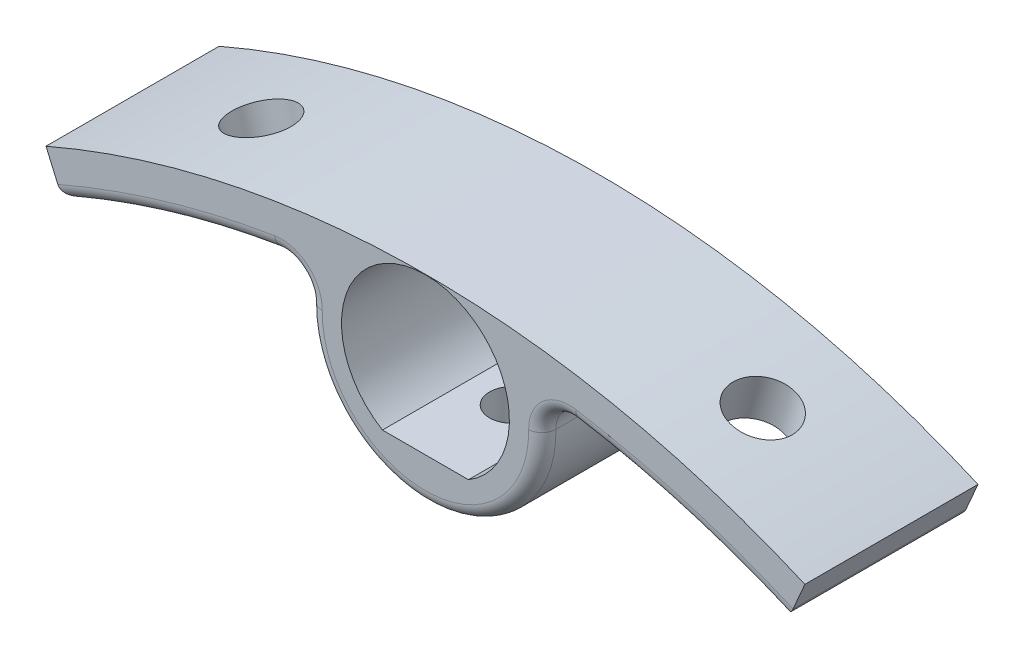
from build123d import *

# Parameters (mm, degrees)
BOSS_EXTRUDE1_DEPTH = 12.7
SKETCH2_R           = 1.651
CUT_EXTRUDE1_DEPTH  = 33.458037303
SKETCH4_R           = 2.25298
CUT_EXTRUDE3_DEPTH  = 34.719236888
FILLET1_R           = 2
FILLET2_R           = 1
CUT_EXTRUDE4_DEPTH  = 34.974608094


with BuildPart() as part:
    # Sketch1 → Boss-Extrude1 (new body)
    with BuildSketch(Plane.XY):
        with BuildLine():
            Line((-27.839103255, -5.787477181), (-26.57368947, -8.699410036))
            ThreePointArc((-26.57368947, -8.699410036), (-17.565333038, -5.530370801), (-8.196652556, -3.680743454))
            ThreePointArc((-8.196652556, -3.680743454), (0, -14.76375), (8.196652556, -3.680743454))
            ThreePointArc((8.196652556, -3.680743454), (17.565333038, -5.530370801), (26.57368947, -8.699410036))
            Line((26.57368947, -8.699410036), (27.839103255, -5.787477181))
            ThreePointArc((27.839103255, -5.787477181), (0, 0), (-27.839103255, -5.787477181))
        make_face()
        with BuildLine():
            Line((-2.764985714, -10.82675), (2.764985714, -10.82675))
            ThreePointArc((2.764985714, -10.82675), (0, -0.79375), (-2.764985714, -10.82675))
        make_face(mode=Mode.SUBTRACT)
    extrude(amount=BOSS_EXTRUDE1_DEPTH)

    # Sketch2 → Cut-Extrude1 (cut, through all)
    with BuildSketch(Plane(origin=(0, -10.82675, 0), x_dir=(1, 0, 0), z_dir=(0, 1, 0))):
        with Locations(Location((0, -6.35, 0), (0, 0, 270))):
            Circle(SKETCH2_R)
    extrude(amount=-CUT_EXTRUDE1_DEPTH, mode=Mode.SUBTRACT)

    # Sketch4 → Cut-Extrude3 (cut, through all)
    with BuildSketch(Plane(origin=(0.366542573, -1.342182486, 0), x_dir=(0.9646738537497861, 0.2634470646857473, 0), z_dir=(-0.2634470646857473, 0.9646738537497861, 0))):
        with Locations((-18.401777468, -6.35)):
            Circle(SKETCH4_R)
    cut_extrude3 = extrude(amount=CUT_EXTRUDE3_DEPTH, mode=Mode.SUBTRACT)

    # Mirror1: Cut-Extrude3 across plane
    add(cut_extrude3.mirror(Plane(origin=(0, 0, 0), x_dir=(0, 0, 1), z_dir=(1, 0, 0))), mode=Mode.SUBTRACT)

    # Fillet1
    fillet1_edges = [part.edges().sort_by_distance(p)[0] for p in [
        (8.196652556, -3.680743454, 6.35),
        (-8.196652556, -3.680743454, 6.35),
    ]]
    fillet(fillet1_edges, radius=FILLET1_R)

    # Fillet2
    fillet2_edges = [part.edges().sort_by_distance(p)[0] for p in [
        (26.57368947, -8.699410036, 6.35),
        (-26.57368947, -8.699410036, 6.35),
        (-18.878378383, -5.903440635, 12.7),
        (0, -14.76375, 0),
        (0, -14.76375, 12.7),
        (18.878378383, -5.903440635, 0),
        (18.878378383, -5.903440635, 12.7),
        (-9.267474809, -4.528405008, 0),
        (-9.267474809, -4.528405008, 12.7),
        (9.267474809, -4.528405008, 0),
        (9.267474809, -4.528405008, 12.7),
        (-18.878378383, -5.903440635, 0),
    ]]
    fillet(fillet2_edges, radius=FILLET2_R)

    # Sketch5 → Cut-Extrude4 (cut, through all)
    with BuildSketch(Plane.XY.offset(12.7)):
        with BuildLine():
            Line((-3.155336639, -11.481173529), (3.155336639, -11.481173529))
            ThreePointArc((3.155336639, -11.481173529), (0, -0.03175), (-3.155336639, -11.481173529))
        make_face()
    extrude(amount=-CUT_EXTRUDE4_DEPTH, mode=Mode.SUBTRACT)


solid = part.part
